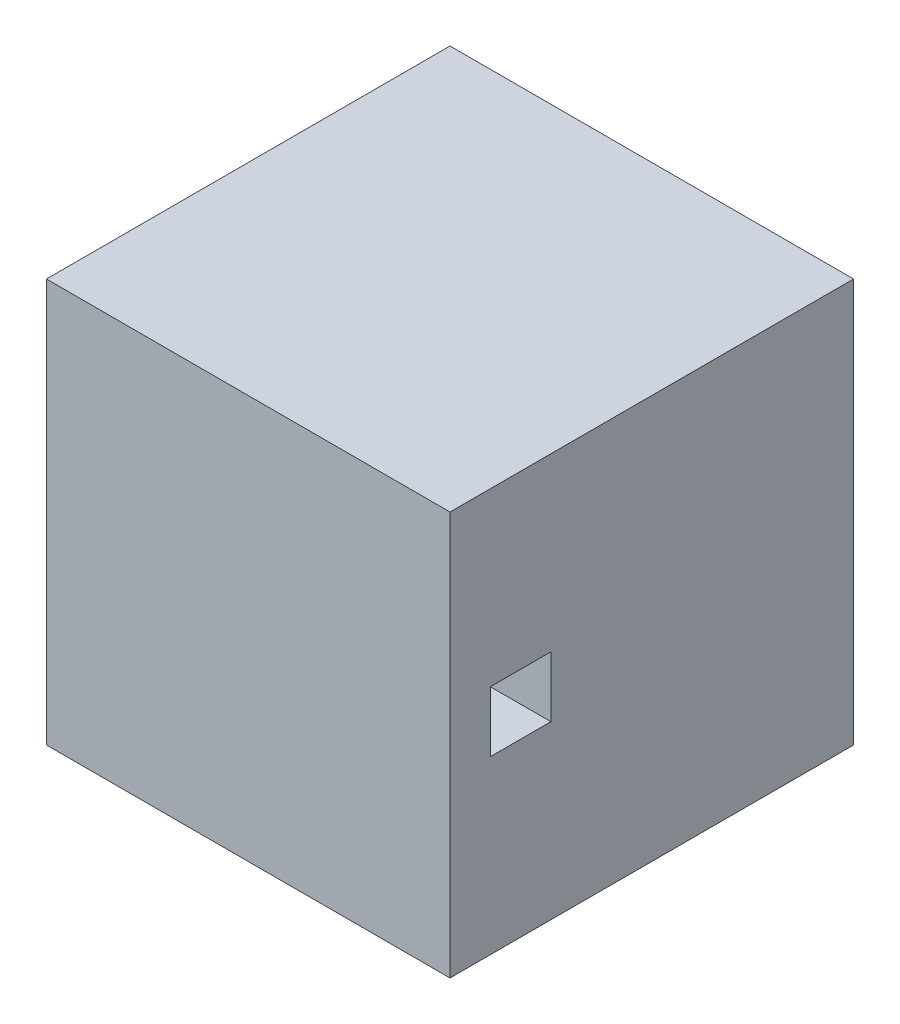
from build123d import *

# Parameters (mm, degrees)
SKETCH1_W           = 25.4
SKETCH1_H           = 25.4
BOSS_EXTRUDE1_DEPTH = 25.4
SKETCH2_W           = 12.7
SKETCH2_H           = 7.62
CUT_EXTRUDE1_DEPTH  = 22.86
SKETCH3_W           = 3.81
SKETCH3_H           = 3.81
CUT_EXTRUDE2_DEPTH  = 22.86


with BuildPart() as part:
    # Sketch1 → Boss-Extrude1 (new body)
    with BuildSketch(Plane.XY):
        Rectangle(SKETCH1_W, SKETCH1_H)
    extrude(amount=BOSS_EXTRUDE1_DEPTH)

    # Sketch2 → Cut-Extrude1 (cut)
    with BuildSketch(Plane(origin=(0, 0, 0), x_dir=(-1, 0, 0), z_dir=(0, 0, -1))):
        with Locations((5.08, 0)):
            Rectangle(SKETCH2_W, SKETCH2_H)
    extrude(amount=-CUT_EXTRUDE1_DEPTH, mode=Mode.SUBTRACT)

    # Sketch3 → Cut-Extrude2 (cut)
    with BuildSketch(Plane(origin=(12.7, 0, 0), x_dir=(0, 0, -1), z_dir=(1, 0, 0))):
        with Locations((-20.955, 0)):
            Rectangle(SKETCH3_W, SKETCH3_H)
    extrude(amount=-CUT_EXTRUDE2_DEPTH, mode=Mode.SUBTRACT)


solid = part.part
